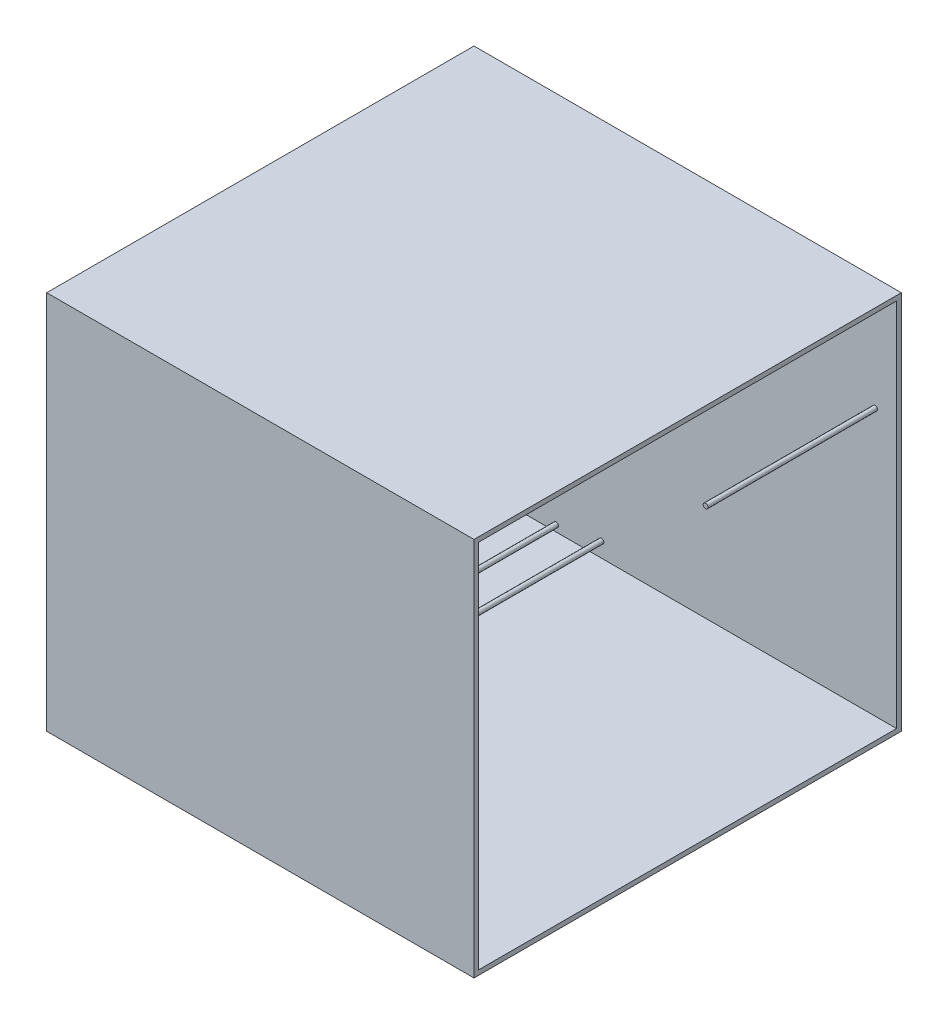
from build123d import *

# Parameters (mm, degrees)
ESBO_O1_W                = 450
ESBO_O1_H                = 400
ESBO_O1_W_2              = 440
ESBO_O1_H_2              = 390
RESSALTO_EXTRUS_O1_DEPTH = 450
ESBO_O2_R                = 2.5
RESSALTO_EXTRUS_O2_DEPTH = 183.55
ESBO_O2_3_R              = 2.5
RESSALTO_EXTRUS_O3_DEPTH = 188.55
ESBO_O2_4_R              = 7.5
RESSALTO_EXTRUS_O4_DEPTH = 181.55
ESBO_O3_R                = 2.5
RESSALTO_EXTRUS_O5_DEPTH = 183.45
ESBO_O3_3_R              = 2.5
RESSALTO_EXTRUS_O6_DEPTH = 183.45
RESSALTO_EXTRUS_O7_START = -120.45
ESBO_O3_4_R              = 7.5
RESSALTO_EXTRUS_O7_DEPTH = 120.45


with BuildPart() as part:
    # Esboço1 → Ressalto-extrusão1 (new body)
    with BuildSketch(Plane(origin=(0, 0, 0), x_dir=(0, 0, -1), z_dir=(1, 0, 0))):
        with Locations((225, 200)):
            Rectangle(ESBO_O1_W, ESBO_O1_H)
        with Locations((225, 200)):
            Rectangle(ESBO_O1_W_2, ESBO_O1_H_2, mode=Mode.SUBTRACT)
    extrude(amount=RESSALTO_EXTRUS_O1_DEPTH)

    # Esboço2 → Ressalto-extrusão2 (add)
    with BuildSketch(Plane.XY):
        with Locations((400.68, 282.17)):
            Circle(ESBO_O2_R)
    extrude(amount=-RESSALTO_EXTRUS_O2_DEPTH)

    # Esboço2<3> → Ressalto-extrusão3 (add)
    with BuildSketch(Plane.XY):
        with Locations((347.87, 268.16)):
            Circle(ESBO_O2_3_R)
    extrude(amount=-RESSALTO_EXTRUS_O3_DEPTH)

    # Esboço2<4> → Ressalto-extrusão4 (add)
    with BuildSketch(Plane.XY):
        with Locations((150.03, 199.95)):
            Circle(ESBO_O2_4_R)
    extrude(amount=-RESSALTO_EXTRUS_O4_DEPTH)

    # Esboço3 → Ressalto-extrusão5 (add)
    with BuildSketch(Plane(origin=(0, 0, -450), x_dir=(-1, 0, 0), z_dir=(0, 0, -1))):
        with Locations((-427.35, 285.92)):
            Circle(ESBO_O3_R)
    extrude(amount=-RESSALTO_EXTRUS_O5_DEPTH)

    # Esboço3<3> → Ressalto-extrusão6 (add)
    with BuildSketch(Plane(origin=(0, 0, -450), x_dir=(-1, 0, 0), z_dir=(0, 0, -1))):
        with Locations((-353.49, 348.09)):
            Circle(ESBO_O3_3_R)
    extrude(amount=-RESSALTO_EXTRUS_O6_DEPTH)

    # Esboço3<4> → Ressalto-extrusão7 (add)
    with BuildSketch(Plane(origin=(0, 0, -450), x_dir=(-1, 0, 0), z_dir=(0, 0, -1)).offset(RESSALTO_EXTRUS_O7_START)):
        with Locations((-150.03, 199.95)):
            Circle(ESBO_O3_4_R)
    extrude(amount=RESSALTO_EXTRUS_O7_DEPTH)


solid = part.part
